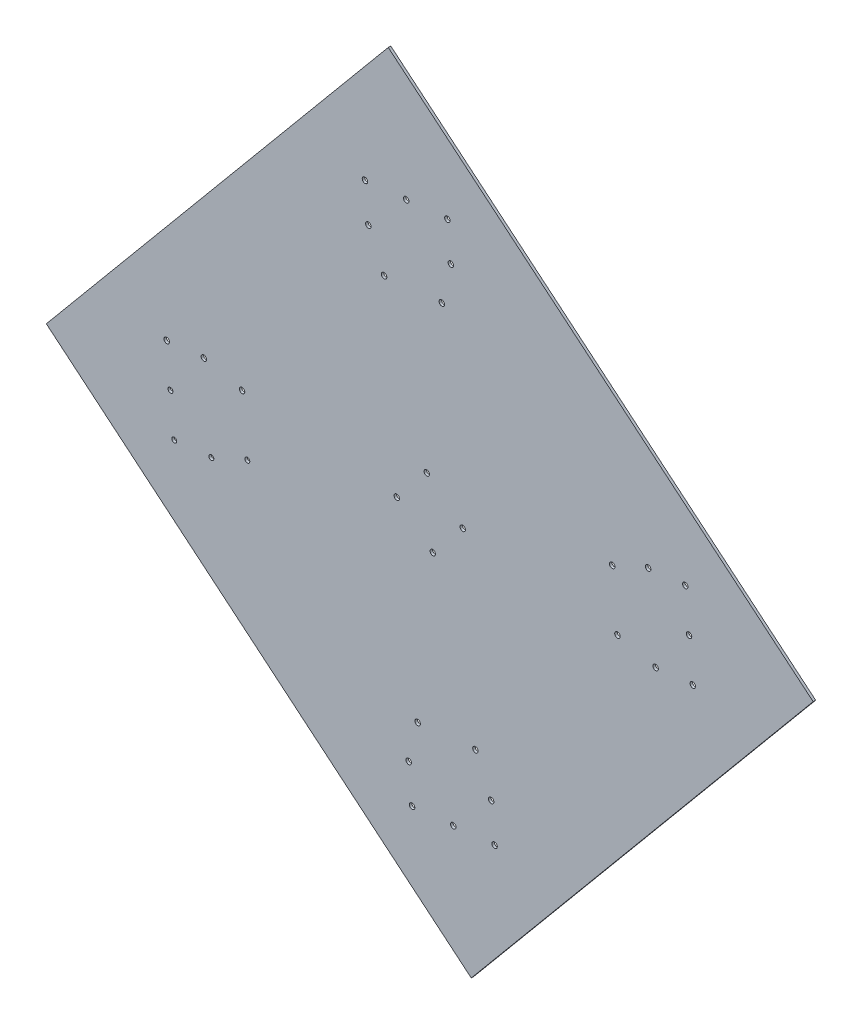
from build123d import *

# Parameters (mm, degrees)
BOSS_EXTRUDE1_DEPTH     = 3
CUT_EXTRUDE1_DEPTH      = 2677.124530624
CUT_EXTRUDE1_DEPTH_BACK = 2677.124530624
SKETCH2_R               = 3
SKETCH2_R_2             = 3.3
SKETCH2_R_3             = 3.25


with BuildPart() as part:
    # Sketch1 → Boss-Extrude1 (new body)
    with BuildSketch(Plane.XY):
        Polygon((964.746903845, -1307.864551018), (551.817114678, -1803.358233337), (1064.979563964, -2231.012650645), (1477.909353131, -1735.518968326), align=None)
    extrude(amount=BOSS_EXTRUDE1_DEPTH)

    # Sketch2 → Cut-Extrude1 (cut, two sides: drawn at the far end of the back side and taken through both)
    with BuildSketch(Plane.XY.offset(3).offset(-CUT_EXTRUDE1_DEPTH_BACK)):
        with Locations((794.552341263, -1824.606259686)):
            Circle(SKETCH2_R)
        with Locations((701.753786497, -1797.896182314)):
            Circle(SKETCH2_R)
        with Locations((706.279483297, -1847.690941762)):
            Circle(SKETCH2_R)
        with Locations((751.0947668, -1843.617814641)):
            Circle(SKETCH2_R)
        with Locations((697.228089696, -1748.101422866)):
            Circle(SKETCH2_R_2)
        with Locations((742.043373199, -1744.028295746)):
            Circle(SKETCH2_R_2)
        with Locations((788.216365742, -1754.893596459)):
            Circle(SKETCH2_R_2)
        with Locations((1054.699041463, -1765.818043391)):
            Circle(SKETCH2_R_3)
        with Locations((1011.242676464, -1729.602793273)):
            Circle(SKETCH2_R_3)
        with Locations((975.027426346, -1773.059158272)):
            Circle(SKETCH2_R_3)
        with Locations((1018.483791345, -1809.27440839)):
            Circle(SKETCH2_R_3)
        with Locations((959.695575049, -1549.12770819)):
            Circle(SKETCH2_R_2)
        with Locations((940.684020094, -1505.670133727)):
            Circle(SKETCH2_R_2)
        with Locations((936.610892974, -1460.854850224)):
            Circle(SKETCH2_R_2)
        with Locations((986.405652422, -1456.329153423)):
            Circle(SKETCH2_R_2)
        with Locations((1036.200411869, -1451.803456623)):
            Circle(SKETCH2_R_2)
        with Locations((1040.27353899, -1496.618740126)):
            Circle(SKETCH2_R_2)
        with Locations((1029.408238276, -1542.791732669)):
            Circle(SKETCH2_R_2)
        with Locations((993.52605594, -2087.07374504)):
            Circle(SKETCH2_R_2)
        with Locations((1043.320815388, -2082.548048239)):
            Circle(SKETCH2_R_2)
        with Locations((989.452928819, -2042.258461537)):
            Circle(SKETCH2_R_2)
        with Locations((1000.318229533, -1996.085468994)):
            Circle(SKETCH2_R_2)
        with Locations((1070.03089276, -1989.749493473)):
            Circle(SKETCH2_R_2)
        with Locations((1089.042447715, -2033.207067936)):
            Circle(SKETCH2_R_2)
        with Locations((1093.115574835, -2078.022351439)):
            Circle(SKETCH2_R_2)
        with Locations((1241.510102067, -1783.983605203)):
            Circle(SKETCH2_R_2)
        with Locations((1287.68309461, -1794.848905917)):
            Circle(SKETCH2_R_2)
        with Locations((1332.498378113, -1790.775778796)):
            Circle(SKETCH2_R_2)
        with Locations((1327.972681313, -1740.981019348)):
            Circle(SKETCH2_R_2)
        with Locations((1323.446984512, -1691.186259901)):
            Circle(SKETCH2_R_2)
        with Locations((1278.631701009, -1695.259387021)):
            Circle(SKETCH2_R_2)
        with Locations((1235.174126546, -1714.270941976)):
            Circle(SKETCH2_R_2)
    extrude(amount=CUT_EXTRUDE1_DEPTH + CUT_EXTRUDE1_DEPTH_BACK, mode=Mode.SUBTRACT)


solid = part.part
